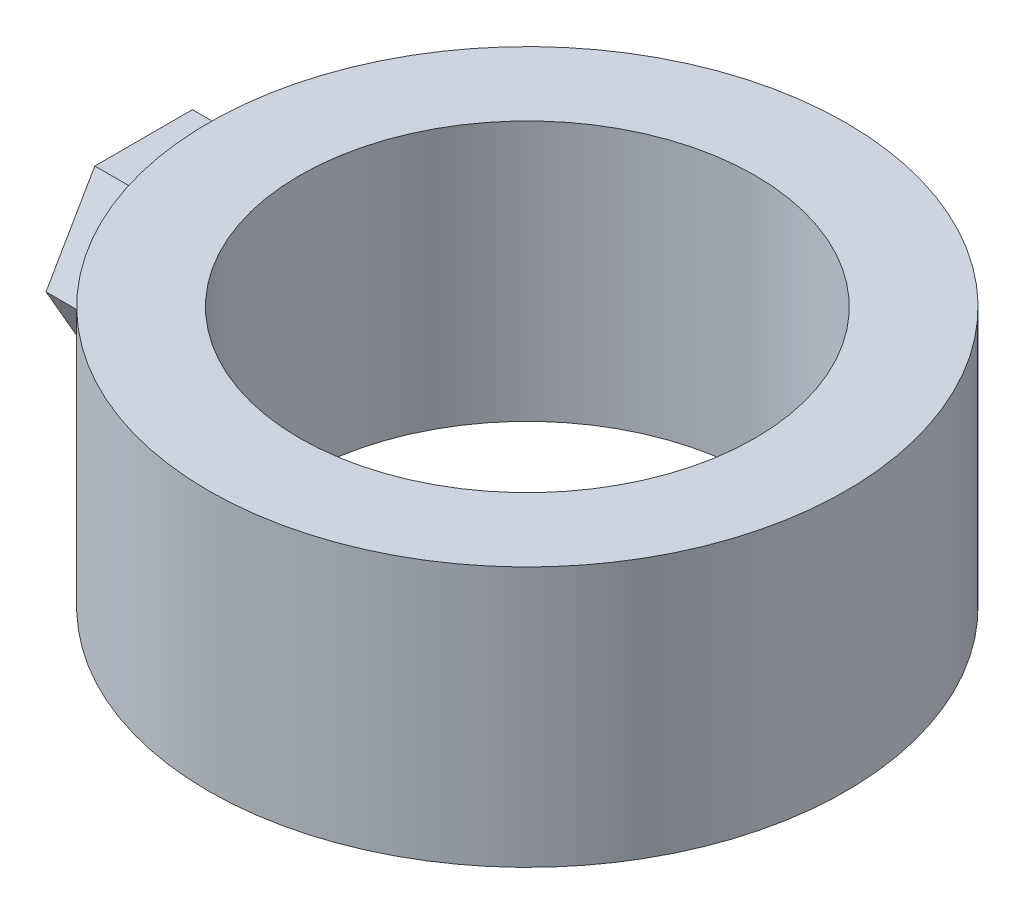
from build123d import *

# Parameters (mm, degrees)
SKETCH_2_R          = 24.5
SKETCH_2_R_2        = 17.5
EXTRUDE_1_DEPTH     = 10
EXTRUDE_START       = -20
EXTRUDE_2_DEPTH     = 9.5
SKETCH_4_R          = 4
CUT_EXTRUDE_2_DEPTH = 5


with BuildPart() as part:
    # Эскиз2 → Бобышка-Вытянуть1 (new, symmetric)
    with BuildSketch(Plane(origin=(0, 0, 0), x_dir=(1, 0, 0), z_dir=(0, 1, 0))):
        with Locations(Location((0, 0, 0), (0, 0, 270))):
            Circle(SKETCH_2_R)
        with Locations(Location((0, 0, 0), (0, 0, 270))):
            Circle(SKETCH_2_R_2, mode=Mode.SUBTRACT)
    extrude(amount=EXTRUDE_1_DEPTH, both=True)

    # Эскиз3 → Бобышка-Вытянуть2 (add)
    with BuildSketch(Plane(origin=(0, 0, 0), x_dir=(0, 0, -1), z_dir=(1, 0, 0)).offset(EXTRUDE_START)):
        Polygon((7.505553499, 0), (3.75277675, 6.5), (-3.75277675, 6.5), (-7.505553499, 0), (-3.75277675, -6.5), (3.75277675, -6.5), align=None)
    extrude(amount=-EXTRUDE_2_DEPTH)

    # Эскиз4 → Вырез-Вытянуть2 (cut)
    with BuildSketch(Plane.ZY.offset(29.5)):
        Circle(SKETCH_4_R)
    extrude(amount=-CUT_EXTRUDE_2_DEPTH, mode=Mode.SUBTRACT)


solid = part.part
